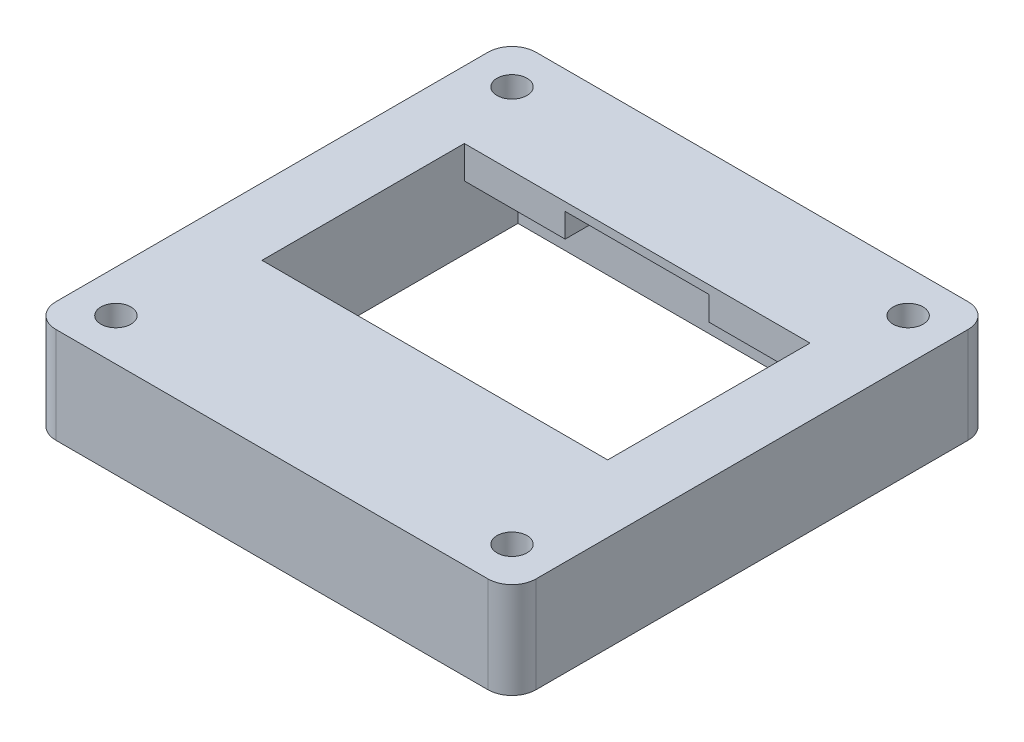
from build123d import *

# Parameters (mm, degrees)
SKETCH_1_W             = 40
SKETCH_1_H             = 40
EXTRUDE_637_DEPTH      = 8
SKETCH_2_W             = 28.8
SKETCH_2_H             = 29.8
CUT_EXTRUDE_819_DEPTH  = 5.3
SKETCH_3_W             = 28.8
SKETCH_3_H             = 20.86
CUT_EXTRUDE_1010_DEPTH = 29.776552955
SKETCH_4_W             = 12
SKETCH_4_H             = 4.47
CUT_EXTRUDE_1227_DEPTH = 2
SKETCH_5_W             = 28.8
SKETCH_5_H             = 0.5
EXTRUDE_1458_DEPTH     = 4
SKETCH_7_R             = 1.25
CUT_EXTRUDE_1697_DEPTH = 30.393876913
FILLET_1_R             = 2


with BuildPart() as part:
    # Эскиз1 → Extrude 637 (new body)
    with BuildSketch(Plane(origin=(0, 0, 0), x_dir=(1, 0, 0), z_dir=(0, 1, 0))):
        Rectangle(SKETCH_1_W, SKETCH_1_H)
    extrude(amount=EXTRUDE_637_DEPTH)

    # Эскиз2 → Cut-Extrude 819 (cut)
    with BuildSketch(Plane.XZ):
        Rectangle(SKETCH_2_W, SKETCH_2_H)
    extrude(amount=-CUT_EXTRUDE_819_DEPTH, mode=Mode.SUBTRACT)

    # Эскиз3 → Cut-Extrude 1010 (cut, through all)
    with BuildSketch(Plane.XZ.offset(-5.3)):
        Rectangle(SKETCH_3_W, SKETCH_3_H)
    extrude(amount=-CUT_EXTRUDE_1010_DEPTH, mode=Mode.SUBTRACT)

    # Эскиз4 → Cut-Extrude 1227 (cut)
    with BuildSketch(Plane.XZ.offset(-5.3)):
        with Locations((0, 12.665)):
            Rectangle(SKETCH_4_W, SKETCH_4_H)
        with Locations((0, -12.665)):
            Rectangle(SKETCH_4_W, SKETCH_4_H)
    extrude(amount=-CUT_EXTRUDE_1227_DEPTH, mode=Mode.SUBTRACT)

    # Эскиз5 → Extrude 1458 (add)
    with BuildSketch(Plane(origin=(0, 0, 10.43), x_dir=(-1, 0, 0), z_dir=(0, 0, -1))):
        with Locations((0, 7.75)):
            Rectangle(SKETCH_5_W, SKETCH_5_H)
    extrude(amount=EXTRUDE_1458_DEPTH)

    # Эскиз7 → Cut-Extrude 1697 (cut, through all)
    with BuildSketch(Plane.XZ):
        with Locations(Location((-16.5, 16.5, 0), (0, 0, 270))):
            Circle(SKETCH_7_R)
        with Locations(Location((16.5, 16.5, 0), (0, 0, 270))):
            Circle(SKETCH_7_R)
        with Locations(Location((16.5, -16.5, 0), (0, 0, 270))):
            Circle(SKETCH_7_R)
        with Locations(Location((-16.5, -16.5, 0), (0, 0, 270))):
            Circle(SKETCH_7_R)
    extrude(amount=-CUT_EXTRUDE_1697_DEPTH, mode=Mode.SUBTRACT)

    # Скругление1
    fillet_1_edges = [part.edges().sort_by_distance(p)[0] for p in [
        (20, 4, 20),
        (-20, 4, 20),
        (-20, 4, -20),
        (20, 4, -20),
    ]]
    fillet(fillet_1_edges, radius=FILLET_1_R)


solid = part.part
